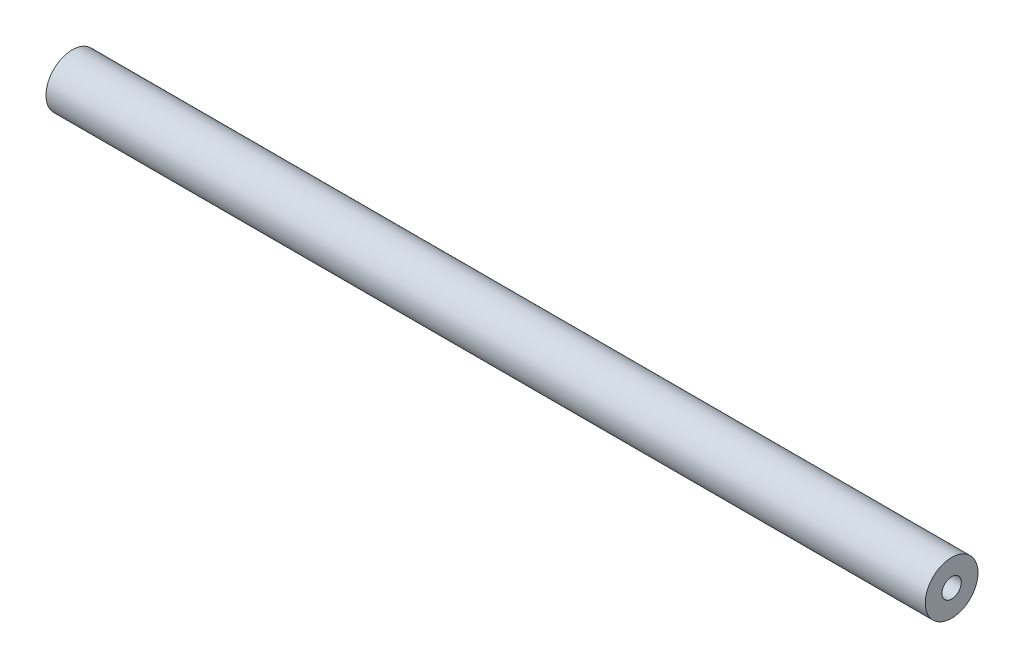
from build123d import *

# Parameters (mm, degrees)
SKETCH_1_R      = 4.5
SKETCH_1_R_2    = 1.65
EXTRUDE_1_DEPTH = 150


with BuildPart() as part:
    # 草图1 → 凸台-拉伸1 (new body)
    with BuildSketch(Plane(origin=(0, 0, 0), x_dir=(0, 0, -1), z_dir=(1, 0, 0))):
        Circle(SKETCH_1_R)
        Circle(SKETCH_1_R_2, mode=Mode.SUBTRACT)
    extrude(amount=EXTRUDE_1_DEPTH)


solid = part.part
